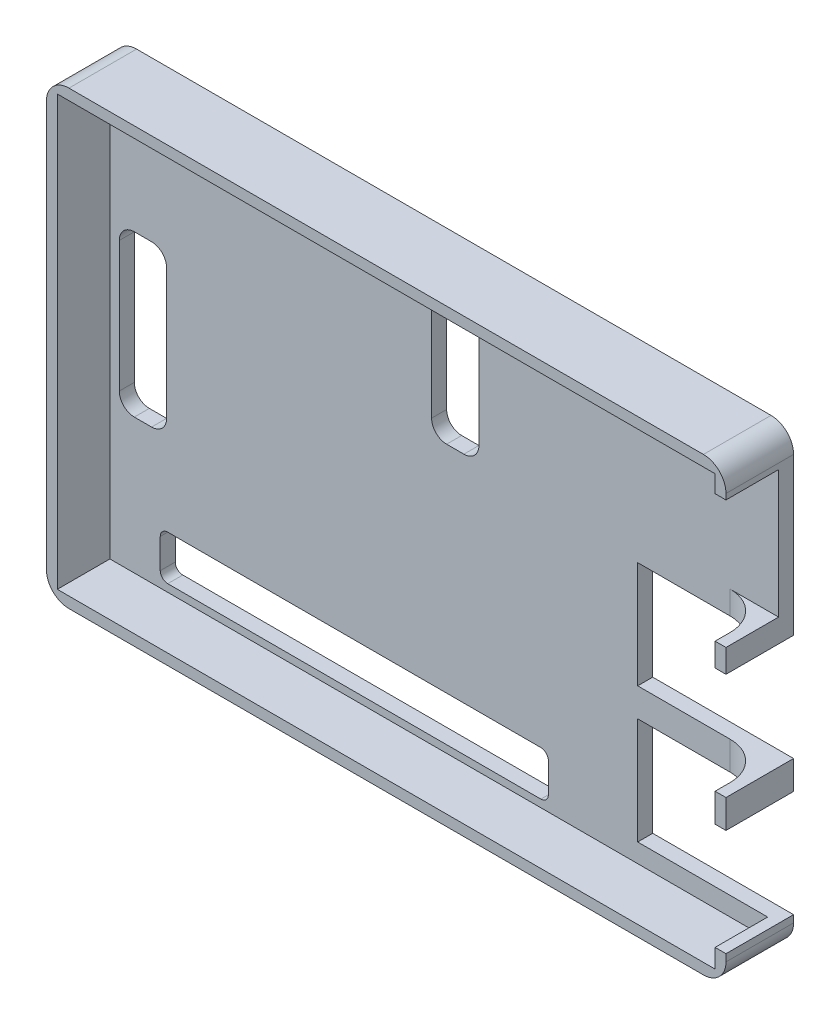
from build123d import *

# Parameters (mm, degrees)
CROQUIS1_W              = 90.45
CROQUIS1_H              = 60
SALIENTE_EXTRUIR1_DEPTH = 2
CROQUIS2_W              = 90.45
CROQUIS2_H              = 60
CROQUIS2_W_2            = 87.55
CROQUIS2_H_2            = 57.1
SALIENTE_EXTRUIR2_DEPTH = 7
CORTAR_EXTRUIR1_START   = -9
CROQUIS3_W              = 18.75
CROQUIS3_H              = 14.2
CORTAR_EXTRUIR1_DEPTH   = 9
CORTAR_EXTRUIR2_REACH   = 97.552
CROQUIS4_W              = 7
CROQUIS4_H              = 17
REDONDEO2_R             = 3
CROQUIS5_W              = 51.66
CROQUIS5_H              = 5.94
CORTAR_EXTRUIR3_DEPTH   = 2
CROQUIS6_W              = 6.3
CROQUIS6_H              = 21.36
CORTAR_EXTRUIR4_DEPTH   = 2
REDONDEO3_R             = 2
REDONDEO4_R             = 1
REDONDEO5_R             = 5


with BuildPart() as part:
    # Croquis1 → Saliente-Extruir1 (new body)
    with BuildSketch(Plane.XY):
        Rectangle(CROQUIS1_W, CROQUIS1_H)
    extrude(amount=-SALIENTE_EXTRUIR1_DEPTH)

    # Croquis2 → Saliente-Extruir2 (add)
    with BuildSketch(Plane.XY):
        Rectangle(CROQUIS2_W, CROQUIS2_H)
        Rectangle(CROQUIS2_W_2, CROQUIS2_H_2, mode=Mode.SUBTRACT)
    extrude(amount=SALIENTE_EXTRUIR2_DEPTH)

    # Croquis3 → Cortar-Extruir1 (cut)
    with BuildSketch(Plane(origin=(0, 0, -2), x_dir=(-1, 0, 0), z_dir=(0, 0, -1)).offset(CORTAR_EXTRUIR1_START)):
        with Locations((-35.85, -18.95)):
            Rectangle(CROQUIS3_W, CROQUIS3_H)
        with Locations((-35.85, -0.95)):
            Rectangle(CROQUIS3_W, CROQUIS3_H)
    extrude(amount=CORTAR_EXTRUIR1_DEPTH, mode=Mode.SUBTRACT)

    # Croquis4 → Cortar-Extruir2 (cut, up to next)
    with BuildSketch(Plane(origin=(45.225, 0, 0), x_dir=(0, 0, -1), z_dir=(1, 0, 0)), mode=Mode.PRIVATE) as cortar_extruir2_sk1:
        with Locations((-3.5, 17.75)):
            Rectangle(CROQUIS4_W, CROQUIS4_H)
    cortar_extruir2_tool1 = extrude(cortar_extruir2_sk1.sketch, amount=-CORTAR_EXTRUIR2_REACH, mode=Mode.PRIVATE) & part.part
    add(cortar_extruir2_tool1.solids().sort_by_distance((45.225, 17.75, 3.5))[0], mode=Mode.SUBTRACT)

    # Redondeo2
    redondeo2_edges = [part.edges().sort_by_distance(p)[0] for p in [
        (45.225, -30, 2.5),
        (-45.225, -30, 2.5),
        (-45.225, 30, 2.5),
        (45.225, 30, 2.5),
    ]]
    fillet(redondeo2_edges, radius=REDONDEO2_R)

    # Croquis5 → Cortar-Extruir3 (cut)
    with BuildSketch(Plane(origin=(0, 0, -2), x_dir=(-1, 0, 0), z_dir=(0, 0, -1))):
        with Locations((11.245, -24.58)):
            Rectangle(CROQUIS5_W, CROQUIS5_H)
    extrude(amount=-CORTAR_EXTRUIR3_DEPTH, mode=Mode.SUBTRACT)

    # Croquis6 → Cortar-Extruir4 (cut)
    with BuildSketch(Plane(origin=(0, 0, -2), x_dir=(-1, 0, 0), z_dir=(0, 0, -1))):
        with Locations((39.375, 0.11)):
            Rectangle(CROQUIS6_W, CROQUIS6_H)
        with Locations((-2.195, 17.77)):
            Rectangle(CROQUIS6_W, CROQUIS6_H)
    extrude(amount=-CORTAR_EXTRUIR4_DEPTH, mode=Mode.SUBTRACT)

    # Redondeo3
    redondeo3_edges = [part.edges().sort_by_distance(p)[0] for p in [
        (-36.225, -10.57, -1),
        (-36.225, 10.79, -1),
        (-42.525, 10.79, -1),
        (-42.525, -10.57, -1),
        (5.345, 7.09, -1),
        (5.345, 28.45, -1),
        (-0.955, 28.45, -1),
        (-0.955, 7.09, -1),
    ]]
    fillet(redondeo3_edges, radius=REDONDEO3_R)

    # Redondeo4
    redondeo4_edges = [part.edges().sort_by_distance(p)[0] for p in [
        (14.585, -27.55, -1),
        (14.585, -21.61, -1),
        (-37.075, -21.61, -1),
        (-37.075, -27.55, -1),
    ]]
    fillet(redondeo4_edges, radius=REDONDEO4_R)

    # Redondeo5
    redondeo5_edges = [part.edges().sort_by_distance(p)[0] for p in [
        (43.775, -9.95, 0),
        (43.775, 7.7, 0),
    ]]
    fillet(redondeo5_edges, radius=REDONDEO5_R)


solid = part.part
